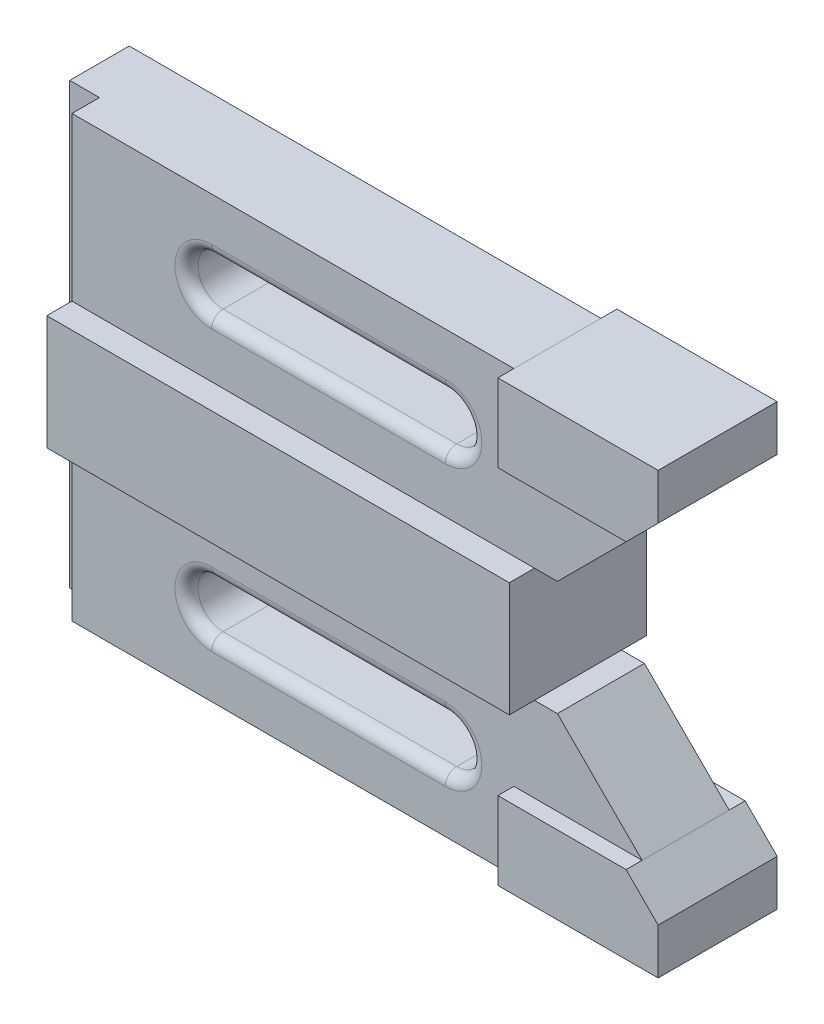
from build123d import *

# Parameters (mm, degrees)
SKETCH1_W             = 101
SKETCH1_H             = 25
BOSS_EXTRUDE1_DEPTH   = 15
BOSS_EXTRUDE2_DEPTH   = 13
BOSS_EXTRUDE2_2_DEPTH = 13
BOSS_EXTRUDE3_DEPTH   = 9.5
BOSS_EXTRUDE3_2_DEPTH = 9.5
FILLET1_R             = 2.5
FILLET2_R             = 2.5
SKETCH1_9_W           = 6.5
SKETCH1_9_H           = 96
BOSS_EXTRUDE5_DEPTH   = 9.5
SKETCH1_10_W          = 6.5
SKETCH1_10_H          = 96
BOSS_EXTRUDE6_DEPTH   = 3.5
SKETCH2_W             = 5.5
SKETCH2_H             = 25
BOSS_EXTRUDE7_DEPTH   = 6.5


with BuildPart() as part:
    # Sketch1 → Boss-Extrude1 (new, symmetric)
    with BuildSketch(Plane.XY):
        with Locations((57, 48)):
            Rectangle(SKETCH1_W, SKETCH1_H)
    extrude(amount=BOSS_EXTRUDE1_DEPTH, both=True)



with BuildPart() as body_2:
    # Sketch1<4> → Boss-Extrude2 (new, symmetric)
    with BuildSketch(Plane.XY):
        Polygon((103, 17), (103, 0), (138, 0), (138, 10), (131, 17), align=None)
    extrude(amount=BOSS_EXTRUDE2_DEPTH, both=True)


with BuildPart() as body_3:
    # Sketch1<4> → Boss-Extrude2 2 (new, symmetric)
    with BuildSketch(Plane.XY):
        Polygon((138, 96), (103, 96), (103, 79), (131, 79), (138, 86), align=None)
    extrude(amount=BOSS_EXTRUDE2_2_DEPTH, both=True)


with BuildPart() as body_4:
    # Sketch1<5> → Boss-Extrude3 (new, symmetric)
    with BuildSketch(Plane.XY):
        Polygon((103, 96), (6.5, 96), (6.5, 60.5), (107.5, 60.5), (112.5, 60.5), (131, 79), (103, 79), align=None)
        with BuildLine():
            ThreePointArc((37, 73), (31.5, 78.5), (37, 84))
            Line((37, 84), (88, 84))
            ThreePointArc((88, 84), (93.5, 78.5), (88, 73))
            Line((88, 73), (37, 73))
        make_face(mode=Mode.SUBTRACT)
    extrude(amount=BOSS_EXTRUDE3_DEPTH, both=True)

    # Fillet1
    fillet1_edges = [body_4.edges().sort_by_distance(p)[0] for p in [
        (62.5, 73, 9.5),
        (62.5, 84, -9.5),
        (31.5, 78.5, 9.5),
        (31.5, 78.5, -9.5),
        (62.5, 73, -9.5),
        (93.5, 78.5, -9.5),
        (62.5, 84, 9.5),
        (93.5, 78.5, 9.5),
    ]]
    fillet(fillet1_edges, radius=FILLET1_R)


with BuildPart() as body_5:
    # Sketch1<5> → Boss-Extrude3 2 (new, symmetric)
    with BuildSketch(Plane.XY):
        Polygon((107.5, 35.5), (6.5, 35.5), (6.5, 0), (103, 0), (103, 17), (131, 17), (112.5, 35.5), align=None)
        with BuildLine():
            ThreePointArc((37, 12), (31.5, 17.5), (37, 23))
            Line((37, 23), (88, 23))
            ThreePointArc((88, 23), (93.5, 17.5), (88, 12))
            Line((88, 12), (37, 12))
        make_face(mode=Mode.SUBTRACT)
    extrude(amount=BOSS_EXTRUDE3_2_DEPTH, both=True)

    # Fillet2
    fillet2_edges = [body_5.edges().sort_by_distance(p)[0] for p in [
        (62.5, 12, 9.5),
        (62.5, 23, -9.5),
        (31.5, 17.5, 9.5),
        (31.5, 17.5, -9.5),
        (62.5, 12, -9.5),
        (93.5, 17.5, -9.5),
        (62.5, 23, 9.5),
        (93.5, 17.5, 9.5),
    ]]
    fillet(fillet2_edges, radius=FILLET2_R)


with BuildPart() as part_1:
    add(part.part)

    add(body_4.part)  # Boss-Extrude5 merges body 4

    add(body_5.part)  # Boss-Extrude5 merges body 5
    # Sketch1<9> → Boss-Extrude5 (add)
    with BuildSketch(Plane.XY):
        with Locations((3.25, 48)):
            Rectangle(SKETCH1_9_W, SKETCH1_9_H)
    extrude(amount=-BOSS_EXTRUDE5_DEPTH)

    # Sketch1<10> → Boss-Extrude6 (add)
    with BuildSketch(Plane.XY):
        with Locations((3.25, 48)):
            Rectangle(SKETCH1_10_W, SKETCH1_10_H)
    extrude(amount=BOSS_EXTRUDE6_DEPTH)

    # Sketch2 → Boss-Extrude7 (add)
    with BuildSketch(Plane.ZY.offset(-6.5)):
        with Locations((-12.25, 48)):
            Rectangle(SKETCH2_W, SKETCH2_H)
    extrude(amount=BOSS_EXTRUDE7_DEPTH)


solid = Compound([body_2.part, body_3.part, part_1.part])
